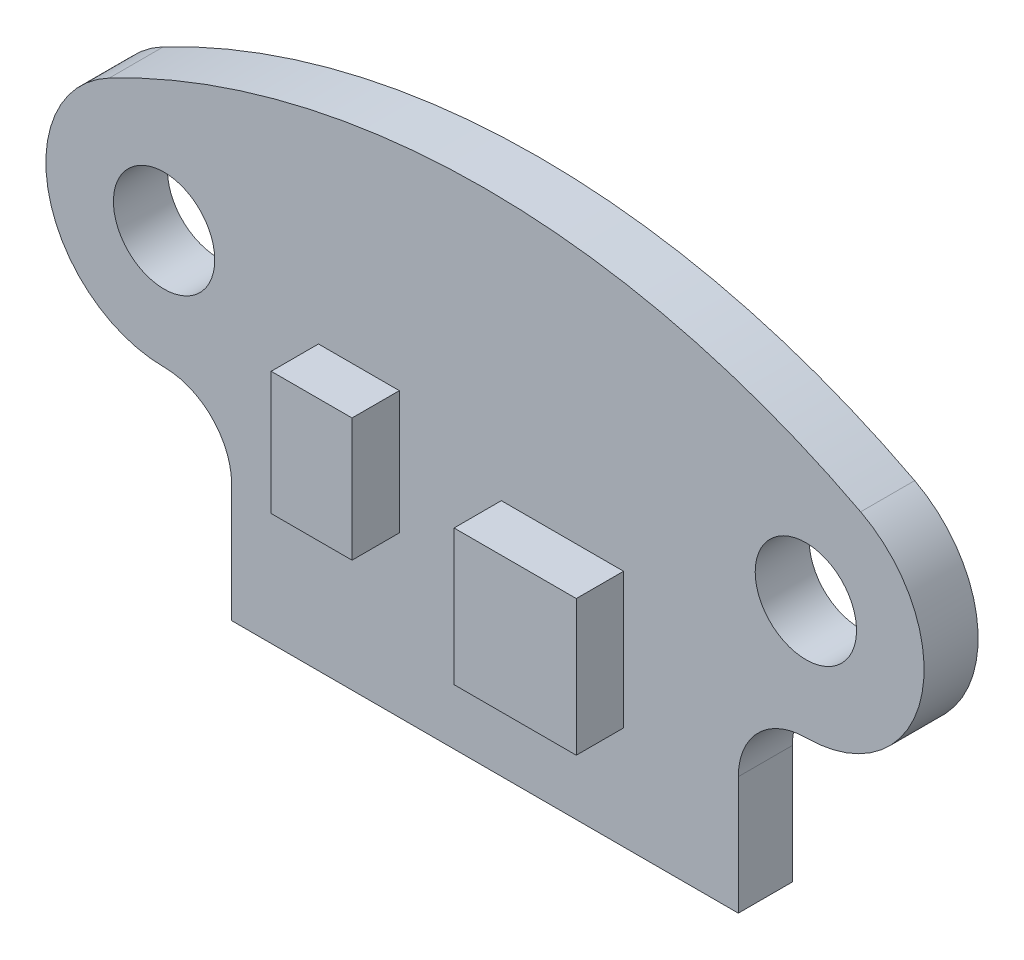
from build123d import *

# Parameters (mm, degrees)
SKETCH_1_W      = 15
SKETCH_1_H      = 13
EXTRUDE_1_DEPTH = 1.6
SKETCH_2_R      = 3.5
SKETCH_2_R_2    = 1.5
EXTRUDE_2_DEPTH = 1.6
FILLET_1_R      = 2
SKETCH_3_W      = 3.618558991
SKETCH_3_H      = 4.017455257
SKETCH_3_W_2    = 2.3933776
SKETCH_3_H_2    = 3.647051581
EXTRUDE_3_DEPTH = 1.4
EXTRUDE_4_DEPTH = 1.6


with BuildPart() as part:
    # Эскиз1 → Бобышка-Вытянуть1 (new body)
    with BuildSketch(Plane.XY):
        with Locations((7.5, 6.5)):
            Rectangle(SKETCH_1_W, SKETCH_1_H)
    extrude(amount=EXTRUDE_1_DEPTH)

    # Эскиз2 → Бобышка-Вытянуть2 (add)
    # profile 1 of 2: a face of its own
    with BuildSketch(Plane.XY.offset(1.6)):
        with Locations((-2, 9)):
            Circle(SKETCH_2_R)
        with Locations((-2, 9)):
            Circle(SKETCH_2_R_2, mode=Mode.SUBTRACT)
    # profile 2 of 2: a face of its own
    with BuildSketch(Plane.XY.offset(1.6)):
        with Locations((17, 9)):
            Circle(SKETCH_2_R)
        with Locations(Location((17, 9, 0), (0, 0, 180))):
            Circle(SKETCH_2_R_2, mode=Mode.SUBTRACT)
    extrude(amount=-EXTRUDE_2_DEPTH)

    # Скругление1
    fillet_1_edges = [part.edges().sort_by_distance(p)[0] for p in [
        (0, 6.127718677, 0.8),
        (15, 6.127718677, 0.8),
    ]]
    fillet(fillet_1_edges, radius=FILLET_1_R)

    # Эскиз3 → Бобышка-Вытянуть3 (add)
    with BuildSketch(Plane.XY.offset(1.6)):
        with Locations((9.793653534, 5.059744515)):
            Rectangle(SKETCH_3_W, SKETCH_3_H)
        with Locations((3.767470648, 6.555605515)):
            Rectangle(SKETCH_3_W_2, SKETCH_3_H_2)
    extrude(amount=EXTRUDE_3_DEPTH)

    # Эскиз4 → Бобышка-Вытянуть4 (add)
    with BuildSketch(Plane.XY.offset(1.6)):
        with BuildLine():
            Line((-3.62195122, 12.101495485), (7.5, 9.632875059))
            Line((7.5, 9.632875059), (18.62195122, 12.101495485))
            ThreePointArc((18.62195122, 12.101495485), (7.5, 14.834097875), (-3.62195122, 12.101495485))
        make_face()
    extrude(amount=-EXTRUDE_4_DEPTH)


solid = part.part
